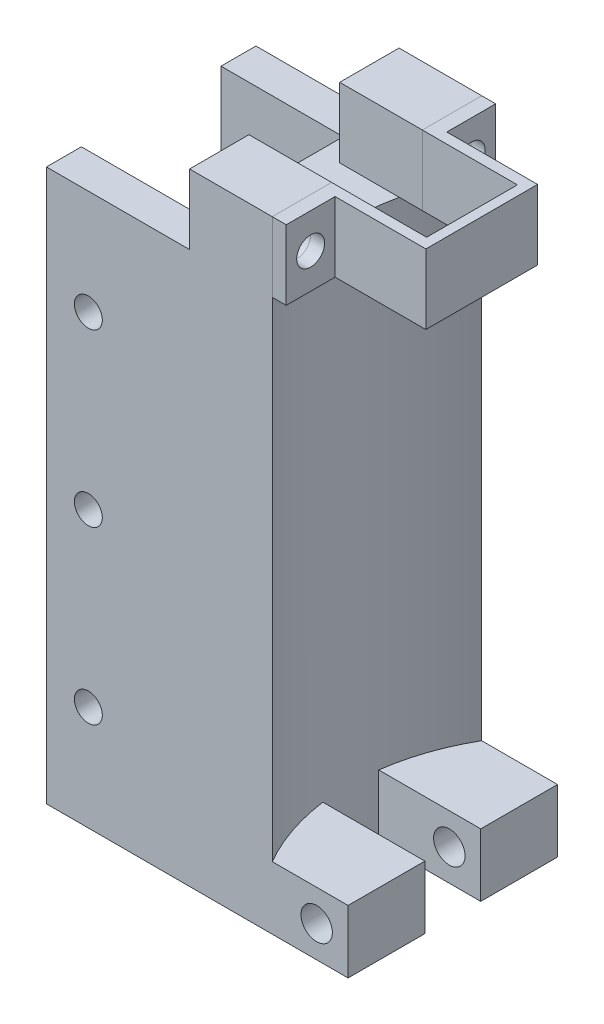
from build123d import *

# Parameters (mm, degrees)
SKETCH1_W               = 15
SKETCH1_H               = 79
BOSS_EXTRUDE1_DEPTH     = 15
CUT_EXTRUDE1_DEPTH      = 81.76044824
CUT_EXTRUDE1_DEPTH_BACK = 70
SKETCH3_W               = 30
SKETCH3_H               = 9
BOSS_EXTRUDE2_DEPTH     = 10.86
SKETCH4_R               = 2.25
CUT_EXTRUDE2_DEPTH      = 50.86
CUT_EXTRUDE3_REACH      = 51.538
CUT_EXTRUDE3_END_RADIUS = 30
SKETCH5_W               = 8
SKETCH5_H               = 9
SKETCH8_W               = 17.34
SKETCH8_H               = 79
BOSS_EXTRUDE3_DEPTH     = 15
SKETCH9_W               = 20
SKETCH9_H               = 79
CUT_EXTRUDE4_DEPTH      = 17.5
SKETCH10_R              = 2
CUT_EXTRUDE5_DEPTH      = 40
SKETCH11_W              = 11.84
SKETCH11_H              = 8.5
BOSS_EXTRUDE4_DEPTH     = 10
SKETCH12_R              = 1.5
CUT_EXTRUDE6_DEPTH      = 15
SKETCH14_W              = 30
SKETCH14_H              = 10
BOSS_EXTRUDE5_DEPTH     = 15
SKETCH15_W              = 13
SKETCH15_H              = 7
CUT_EXTRUDE7_DEPTH      = 13
SPLIT1_SURFACE_1_BACK   = 106.176
SPLIT1_SURFACE_1_DEPTH  = 212.352
SPLIT1_SURFACE_2_BACK   = 106.176
SPLIT1_SURFACE_2_DEPTH  = 212.352
SKETCH18_R              = 2
CUT_EXTRUDE8_DEPTH      = 43


with BuildPart() as part:
    # Sketch1 → Boss-Extrude1 (new, symmetric)
    with BuildSketch(Plane.XY):
        Rectangle(SKETCH1_W, SKETCH1_H)
    extrude(amount=BOSS_EXTRUDE1_DEPTH, both=True)

    # Sketch2 → Cut-Extrude1 (cut, two sides: drawn at the far end of the back side and taken through both)
    with BuildSketch(Plane(origin=(0, 39.5, 0), x_dir=(1, 0, 0), z_dir=(0, 1, 0)).offset(-CUT_EXTRUDE1_DEPTH_BACK)):
        with BuildLine():
            ThreePointArc((7.5, -15), (3.480762114, 0), (7.5, 15))
            Line((7.5, 15), (7.5, -15))
        make_face()
    extrude(amount=CUT_EXTRUDE1_DEPTH + CUT_EXTRUDE1_DEPTH_BACK, mode=Mode.SUBTRACT)

    # Sketch3 → Boss-Extrude2 (add)
    with BuildSketch(Plane(origin=(7.5, 0, 0), x_dir=(0, 0, -1), z_dir=(1, 0, 0))):
        with Locations((0, -35)):
            Rectangle(SKETCH3_W, SKETCH3_H)
    extrude(amount=BOSS_EXTRUDE2_DEPTH)

    # Sketch4 → Cut-Extrude2 (cut)
    with BuildSketch(Plane(origin=(0, 0, -15), x_dir=(-1, 0, 0), z_dir=(0, 0, -1))):
        with Locations((-13.86, -35)):
            Circle(SKETCH4_R)
    extrude(amount=-CUT_EXTRUDE2_DEPTH, mode=Mode.SUBTRACT)

    # Cut-Extrude3: up to this cylinder (the profile starts inside it)
    cut_extrude3_end = Plane(origin=(33.480762114, -35, 0), z_dir=(0, 1, 0)) * Cylinder(CUT_EXTRUDE3_END_RADIUS, 164.076, mode=Mode.PRIVATE)
    # Sketch5 → Cut-Extrude3 (cut, up to the surface)
    with BuildSketch(Plane(origin=(18.36, 0, 0), x_dir=(0, 0, -1), z_dir=(1, 0, 0)), mode=Mode.PRIVATE) as cut_extrude3_sk1:
        with Locations((0, -35)):
            Rectangle(SKETCH5_W, SKETCH5_H)
    cut_extrude3_tool1 = extrude(cut_extrude3_sk1.sketch, amount=-CUT_EXTRUDE3_REACH, mode=Mode.PRIVATE) & cut_extrude3_end
    add(cut_extrude3_tool1.solids().sort_by_distance((18.36, -35, 0))[0], mode=Mode.SUBTRACT)

    # Sketch8 → Boss-Extrude3 (add, symmetric)
    with BuildSketch(Plane.XY):
        with Locations((-16.17, 0)):
            Rectangle(SKETCH8_W, SKETCH8_H)
    extrude(amount=BOSS_EXTRUDE3_DEPTH, both=True)

    # Sketch9 → Cut-Extrude4 (cut, symmetric)
    with BuildSketch(Plane.ZY.offset(24.84)):
        Rectangle(SKETCH9_W, SKETCH9_H)
    extrude(amount=CUT_EXTRUDE4_DEPTH, both=True, mode=Mode.SUBTRACT)

    # Sketch10 → Cut-Extrude5 (cut, symmetric)
    with BuildSketch(Plane.XY.offset(15)):
        with BuildLine():
            ThreePointArc((-16.84, 24.5), (-17.425786438, 25.914213562), (-18.84, 26.5))
            Line((-18.84, 26.5), (-18.84, 22.5))
            ThreePointArc((-18.84, 22.5), (-17.425786438, 23.085786438), (-16.84, 24.5))
        make_face()
        with BuildLine():
            Line((-18.84, 22.5), (-18.84, 26.5))
            ThreePointArc((-18.84, 26.5), (-20.84, 24.5), (-18.84, 22.5))
        make_face()
        with Locations(Location((-18.84, -24.5, 0), (0, 0, 270))):
            Circle(SKETCH10_R)
        with Locations(Location((-18.84, 0, 0), (0, 0, 270))):
            Circle(SKETCH10_R)
    extrude(amount=CUT_EXTRUDE5_DEPTH, both=True, mode=Mode.SUBTRACT)

    # Sketch11 → Boss-Extrude4 (add)
    with BuildSketch(Plane(origin=(0, 39.5, 0), x_dir=(1, 0, 0), z_dir=(0, 1, 0))):
        with Locations((1.58, -10.75)):
            Rectangle(SKETCH11_W, SKETCH11_H)
        with Locations((1.58, 10.75)):
            Rectangle(SKETCH11_W, SKETCH11_H)
    extrude(amount=BOSS_EXTRUDE4_DEPTH)

    # Sketch12 → Cut-Extrude6 (cut, symmetric)
    with BuildSketch(Plane(origin=(7.5, 0, 0), x_dir=(0, 0, -1), z_dir=(1, 0, 0))):
        with Locations((11.25, 44.5)):
            Circle(SKETCH12_R)
        with Locations((-11.25, 44.5)):
            Circle(SKETCH12_R)
    extrude(amount=CUT_EXTRUDE6_DEPTH, both=True, mode=Mode.SUBTRACT)

    # Sketch14 → Boss-Extrude5 (add)
    with BuildSketch(Plane(origin=(7.5, 0, 0), x_dir=(0, 0, -1), z_dir=(1, 0, 0))):
        with Locations((0, 44.5)):
            Rectangle(SKETCH14_W, SKETCH14_H)
    extrude(amount=BOSS_EXTRUDE5_DEPTH)

    # Sketch15 → Cut-Extrude7 (cut)
    with BuildSketch(Plane(origin=(0, 49.5, 0), x_dir=(1, 0, 0), z_dir=(0, 1, 0))):
        with Locations((16, -11.5)):
            Rectangle(SKETCH15_W, SKETCH15_H)
        with Locations((16, 11.5)):
            Rectangle(SKETCH15_W, SKETCH15_H)
        Polygon((8.75, -6.5), (7.5, -6.5), (7.5, 6.5), (8.75, 6.5), (21.11, 6.5), (21.11, -6.5), align=None)
    extrude(amount=-CUT_EXTRUDE7_DEPTH, mode=Mode.SUBTRACT)


with BuildPart() as body_2:
    # Split1: the piece behind the surface
    add(part.part)
    # Split1 surface: a surface, the sketch's curves swept straight by 212.352 mm
    with BuildLine(Plane.XY.offset(15).offset(-SPLIT1_SURFACE_1_BACK), mode=Mode.PRIVATE) as split1_surface_1_path:
        Line((7.5, 39.5), (7.5, 49.5))
    split1_surface_1 = Shell.extrude(split1_surface_1_path.wire(), (0 * SPLIT1_SURFACE_1_DEPTH, 0 * SPLIT1_SURFACE_1_DEPTH, 1 * SPLIT1_SURFACE_1_DEPTH))
    split(bisect_by=split1_surface_1, keep=Keep.BOTTOM)


with BuildPart() as part_1:
    add(part.part)

    # Split1: split by a surface, the side it looks to stays
    # Split1 surface: a surface, the sketch's curves swept straight by 212.352 mm
    with BuildLine(Plane.XY.offset(15).offset(-SPLIT1_SURFACE_2_BACK), mode=Mode.PRIVATE) as split1_surface_2_path:
        Line((7.5, 39.5), (7.5, 49.5))
    split1_surface_2 = Shell.extrude(split1_surface_2_path.wire(), (0 * SPLIT1_SURFACE_2_DEPTH, 0 * SPLIT1_SURFACE_2_DEPTH, 1 * SPLIT1_SURFACE_2_DEPTH))
    split(bisect_by=split1_surface_2, keep=Keep.TOP)


with BuildPart() as cut_extrude8_tool:
    # Sketch18 → Cut-Extrude8 (new body)
    with BuildSketch(Plane(origin=(22.5, 0, 0), x_dir=(0, 0, -1), z_dir=(1, 0, 0))):
        with Locations((-11.5, 44.5)):
            Circle(SKETCH18_R)
        with Locations((11.5, 44.5)):
            Circle(SKETCH18_R)
    extrude(amount=-CUT_EXTRUDE8_DEPTH)


with BuildPart() as part_2:
    add(part_1.part)

    # Cut-Extrude8: cut by cut_extrude8_tool
    add(cut_extrude8_tool.part, mode=Mode.SUBTRACT)


with BuildPart() as body_2_1:
    add(body_2.part)

    # Cut-Extrude8: cut by cut_extrude8_tool
    add(cut_extrude8_tool.part, mode=Mode.SUBTRACT)


solid = Compound([part_2.part, body_2_1.part])
